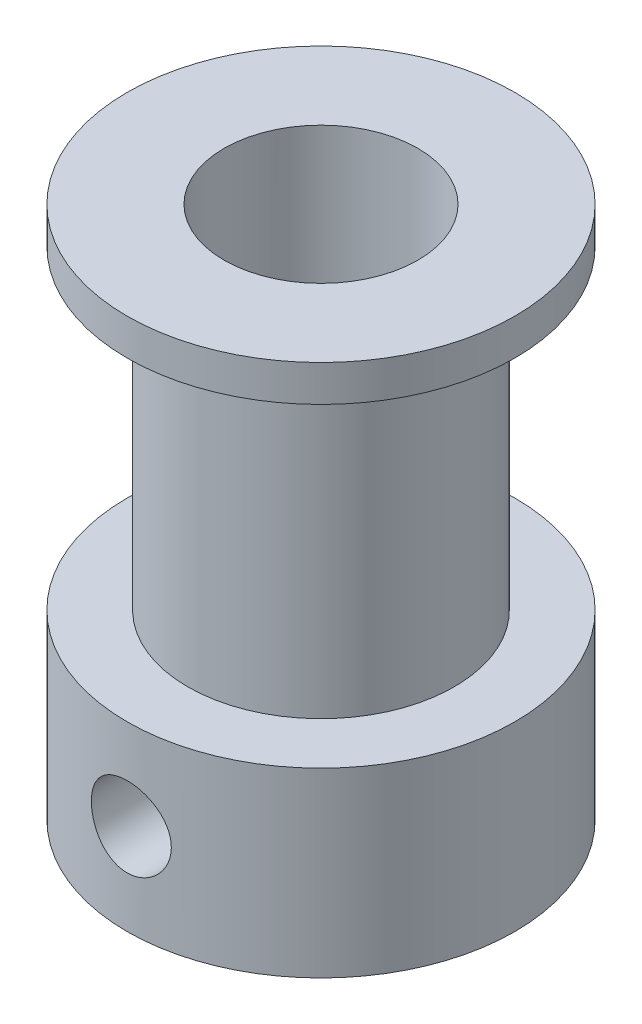
from build123d import *

# Parameters (mm, degrees)
CROQUIS1_R              = 8
SALIENTE_EXTRUIR1_DEPTH = 7.5
CROQUIS2_R              = 5.5
SALIENTE_EXTRUIR2_DEPTH = 13
CROQUIS3_R              = 8
SALIENTE_EXTRUIR3_DEPTH = 1.5
CROQUIS4_R              = 4
CORTAR_EXTRUIR1_DEPTH   = 25.738633754
CROQUIS6_W              = 1.65
CROQUIS6_H              = 8.001
MATRIZC1_COUNT          = 2
MATRIZC1_ANGLE          = 90


with BuildPart() as part:
    # Croquis1 → Saliente-Extruir1 (new body)
    with BuildSketch(Plane(origin=(0, 0, 0), x_dir=(1, 0, 0), z_dir=(0, 1, 0))):
        with Locations(Location((0, 0, 0), (0, 0, 270))):
            Circle(CROQUIS1_R)
    extrude(amount=SALIENTE_EXTRUIR1_DEPTH)

    # Croquis2 → Saliente-Extruir2 (add)
    with BuildSketch(Plane(origin=(0, 7.5, 0), x_dir=(1, 0, 0), z_dir=(0, 1, 0))):
        with Locations(Location((0, 0, 0), (0, 0, 90))):
            Circle(CROQUIS2_R)
    extrude(amount=SALIENTE_EXTRUIR2_DEPTH)

    # Croquis3 → Saliente-Extruir3 (add)
    with BuildSketch(Plane(origin=(0, 20.5, 0), x_dir=(1, 0, 0), z_dir=(0, 1, 0))):
        with Locations(Location((0, 0, 0), (0, 0, 270))):
            Circle(CROQUIS3_R)
    extrude(amount=SALIENTE_EXTRUIR3_DEPTH)

    # Croquis4 → Cortar-Extruir1 (cut, through all)
    with BuildSketch(Plane(origin=(0, 22, 0), x_dir=(1, 0, 0), z_dir=(0, 1, 0))):
        with Locations(Location((0, 0, 0), (0, 0, 270))):
            Circle(CROQUIS4_R)
    extrude(amount=-CORTAR_EXTRUIR1_DEPTH, mode=Mode.SUBTRACT)

    # Croquis6 → Taladro roscado M41 (falta definir posicio) (revolve, cut)
    with BuildSketch(Plane(origin=(0, 3.75, 0), x_dir=(0, 1, 0), z_dir=(1, 0, 0))):
        with Locations((0.825, 4.0005)):
            Rectangle(CROQUIS6_W, CROQUIS6_H)
    taladro_roscado_m41_falta_definir_posic = revolve(axis=Axis((0, 3.75, -6.35), (0, 0, 1)), mode=Mode.SUBTRACT)

    # MatrizC1: Taladro roscado M41 (falta definir posicio) ×2 about axis
    matrizc1_axis = Axis((0, 7.5, 0), (0, -1, 0))
    for i in range(1, MATRIZC1_COUNT):
        add(taladro_roscado_m41_falta_definir_posic.rotate(matrizc1_axis, i * MATRIZC1_ANGLE / (MATRIZC1_COUNT - 1)), mode=Mode.SUBTRACT)


solid = part.part
